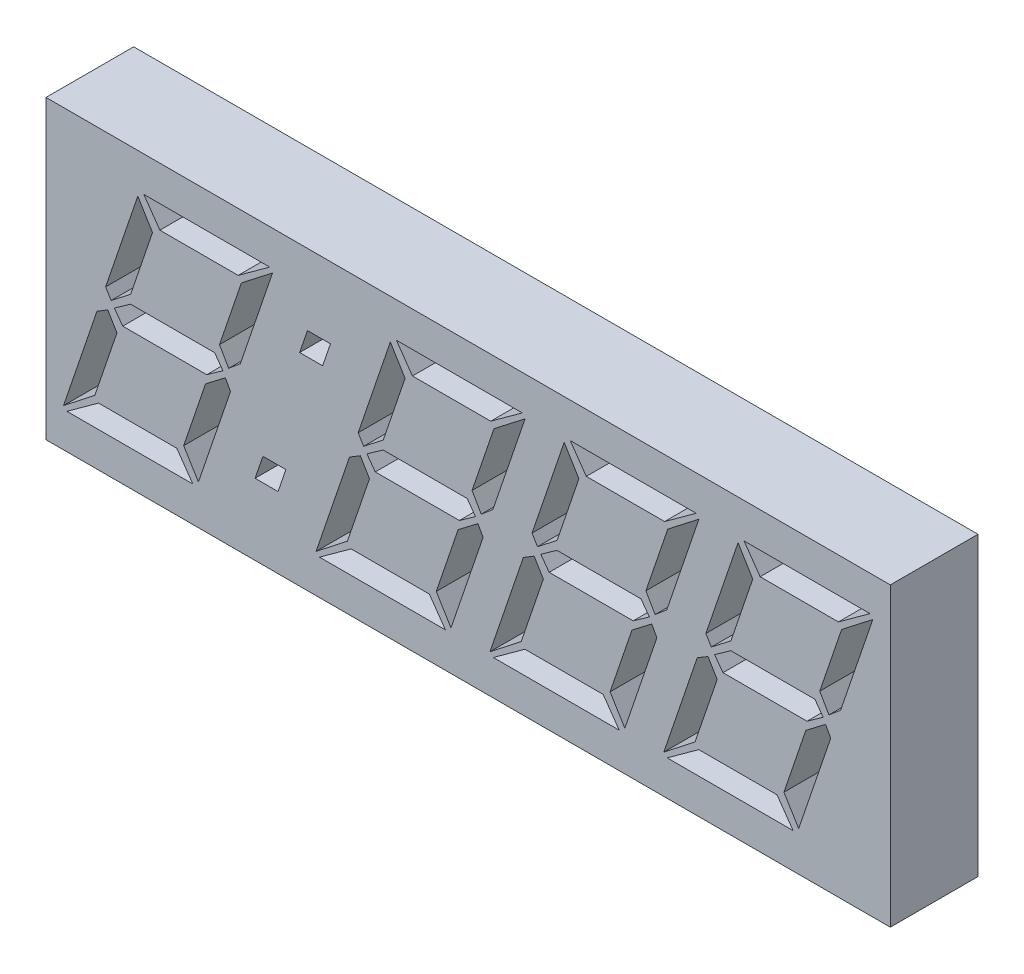
from build123d import *

# Parameters (mm, degrees)
SKETCH_1_W            = 500
SKETCH_1_H            = 220
EXTRUDE_1_DEPTH       = 50
CUT_EXTRUDE_1_DEPTH   = 65
SKETCH_3_W            = 24.993501938
SKETCH_3_H            = 24.754329671
EXTRUDE_2_DEPTH       = 50
SKETCH_4_W            = 557.488309353
SKETCH_4_H            = 263.064748201
SKETCH_4_W_2          = 497.488309353
SKETCH_4_H_2          = 203.064748201
CUT_EXTRUDE_1_2_DEPTH = 84
SCALE_1_SCALE         = 1.5
SKETCH_8_W            = 822.232464029
SKETCH_8_H            = 353.597122302
SKETCH_8_W_2          = 722.232464029
SKETCH_8_H_2          = 253.597122302
CUT_EXTRUDE_2_DEPTH   = 180


with BuildPart() as part:
    # Эскиз1 → Бобышка-Вытянуть1 (new body)
    with BuildSketch(Plane.XY):
        with Locations((315.178539616, -203.237931197)):
            Rectangle(SKETCH_1_W, SKETCH_1_H)
        Polygon((203.546220768, -131.339893042), (185.513397027, -144.433418222), (140.884350264, -144.433418222), (131.736418609, -131.339893042), align=None, mode=Mode.SUBTRACT)
        Polygon((159.677066091, -260.404641243), (87.867263933, -260.404641243), (105.900087674, -247.311116064), (150.529134437, -247.311116064), align=None, mode=Mode.SUBTRACT)
        Polygon((116.392443789, -207.416781531), (103.766544509, -244.593040524), (85.938307098, -258.534137646), (104.994062494, -202.419029733), (111.160879041, -198.678022538), align=None, mode=Mode.SUBTRACT)
        Polygon((109.933361055, -187.922626855), (128.287677602, -133.911835488), (136.67571717, -147.706799517), (124.225177602, -184.41543261), (113.060609257, -193.066511747), align=None, mode=Mode.SUBTRACT)
        Polygon((181.158630839, -203.997267143), (162.86276753, -257.832698797), (154.445501343, -244.066961387), (166.92526753, -207.299875056), (178.20674235, -198.678022538), align=None, mode=Mode.SUBTRACT)
        Polygon((174.874907818, -183.947806711), (187.354674005, -147.239173618), (205.124458178, -133.444209589), (186.770141631, -187.455000956), (180.106472566, -193.066511747), align=None, mode=Mode.SUBTRACT)
        Polygon((172.098379041, -189.325504553), (176.833091271, -195.872267143), (167.626706379, -202.419029733), (119.695051703, -202.419029733), (114.931112854, -195.872267143), (124.166724365, -189.325504553), align=None, mode=Mode.SUBTRACT)
        Polygon((188.173019329, -260.404641243), (192.615465372, -247.311116064), (205.708990552, -247.311116064), (201.266544509, -260.404641243), align=None, mode=Mode.SUBTRACT)
        Polygon((220.585339473, -165.00895779), (225.057012134, -151.91543261), (238.150537314, -151.91543261), (233.678864652, -165.00895779), align=None, mode=Mode.SUBTRACT)
        Polygon((347.574997746, -131.339893042), (329.542174005, -144.433418222), (284.913127242, -144.433418222), (275.765195588, -131.339893042), align=None, mode=Mode.SUBTRACT)
        Polygon((303.70584307, -260.404641243), (231.896040911, -260.404641243), (249.928864652, -247.311116064), (294.557911415, -247.311116064), align=None, mode=Mode.SUBTRACT)
        Polygon((260.421220768, -207.416781531), (247.795321487, -244.593040524), (229.967084077, -258.534137646), (249.022839473, -202.419029733), (255.189656019, -198.678022538), align=None, mode=Mode.SUBTRACT)
        Polygon((253.962138034, -187.922626855), (272.31645458, -133.911835488), (280.704494149, -147.706799517), (268.25395458, -184.41543261), (257.089386235, -193.066511747), align=None, mode=Mode.SUBTRACT)
        Polygon((325.187407818, -203.997267143), (306.891544509, -257.832698797), (298.474278321, -244.066961387), (310.954044509, -207.299875056), (322.235519329, -198.678022538), align=None, mode=Mode.SUBTRACT)
        Polygon((318.903684796, -183.947806711), (331.383450983, -147.239173618), (349.153235156, -133.444209589), (330.798918609, -187.455000956), (324.135249545, -193.066511747), align=None, mode=Mode.SUBTRACT)
        Polygon((316.127156019, -189.325504553), (320.86186825, -195.872267143), (311.655483357, -202.419029733), (263.723828681, -202.419029733), (258.959889832, -195.872267143), (268.195501343, -189.325504553), align=None, mode=Mode.SUBTRACT)
        Polygon((446.711688393, -131.339893042), (428.678864652, -144.433418222), (384.04981789, -144.433418222), (374.901886235, -131.339893042), align=None, mode=Mode.SUBTRACT)
        Polygon((402.842533717, -260.404641243), (331.032731559, -260.404641243), (349.0655553, -247.311116064), (393.694602063, -247.311116064), align=None, mode=Mode.SUBTRACT)
        Polygon((359.557911415, -207.416781531), (346.932012134, -244.593040524), (329.103774724, -258.534137646), (348.15953012, -202.419029733), (354.326346667, -198.678022538), align=None, mode=Mode.SUBTRACT)
        Polygon((353.098828681, -187.922626855), (371.453145228, -133.911835488), (379.841184796, -147.706799517), (367.390645228, -184.41543261), (356.226076883, -193.066511747), align=None, mode=Mode.SUBTRACT)
        Polygon((424.324098465, -203.997267143), (406.028235156, -257.832698797), (397.610968969, -244.066961387), (410.090735156, -207.299875056), (421.372209976, -198.678022538), align=None, mode=Mode.SUBTRACT)
        Polygon((418.040375444, -183.947806711), (430.520141631, -147.239173618), (448.289925804, -133.444209589), (429.935609257, -187.455000956), (423.271940192, -193.066511747), align=None, mode=Mode.SUBTRACT)
        Polygon((415.263846667, -189.325504553), (419.998558897, -195.872267143), (410.792174005, -202.419029733), (362.860519329, -202.419029733), (358.09658048, -195.872267143), (367.332191991, -189.325504553), align=None, mode=Mode.SUBTRACT)
        Polygon((545.848379041, -131.339893042), (527.8155553, -144.433418222), (483.186508537, -144.433418222), (474.038576883, -131.339893042), align=None, mode=Mode.SUBTRACT)
        Polygon((501.979224365, -260.404641243), (430.169422206, -260.404641243), (448.202245947, -247.311116064), (492.83129271, -247.311116064), align=None, mode=Mode.SUBTRACT)
        Polygon((458.694602063, -207.416781531), (446.068702782, -244.593040524), (428.240465372, -258.534137646), (447.296220768, -202.419029733), (453.463037314, -198.678022538), align=None, mode=Mode.SUBTRACT)
        Polygon((452.235519329, -187.922626855), (470.589835875, -133.911835488), (478.977875444, -147.706799517), (466.527335875, -184.41543261), (455.36276753, -193.066511747), align=None, mode=Mode.SUBTRACT)
        Polygon((523.460789113, -203.997267143), (505.164925804, -257.832698797), (496.747659616, -244.066961387), (509.227425804, -207.299875056), (520.508900624, -198.678022538), align=None, mode=Mode.SUBTRACT)
        Polygon((517.177066091, -183.947806711), (529.656832278, -147.239173618), (547.426616451, -133.444209589), (529.072299904, -187.455000956), (522.408630839, -193.066511747), align=None, mode=Mode.SUBTRACT)
        Polygon((514.400537314, -189.325504553), (519.135249545, -195.872267143), (509.928864652, -202.419029733), (461.997209976, -202.419029733), (457.233271127, -195.872267143), (466.468882638, -189.325504553), align=None, mode=Mode.SUBTRACT)
    extrude(amount=EXTRUDE_1_DEPTH)

    # Эскиз2 → Cut-Extrude 1 (cut)
    with BuildSketch(Plane.XY.offset(50)):
        Polygon((225.057012134, -151.91543261), (238.150537314, -151.91543261), (233.678864652, -165.00895779), (220.585339473, -165.00895779), align=None)
        Polygon((199.643902872, -226.731116064), (212.737428052, -226.731116064), (208.26575539, -239.824641243), (195.17223021, -239.824641243), align=None)
    extrude(amount=-CUT_EXTRUDE_1_DEPTH, mode=Mode.SUBTRACT)

    # Эскиз3 → Бобышка-Вытянуть2 (add)
    with BuildSketch(Plane.XY.offset(50)):
        with Locations((196.457377331, -256.289777907)):
            Rectangle(SKETCH_3_W, SKETCH_3_H)
    extrude(amount=-EXTRUDE_2_DEPTH)

    # Эскиз4 → Cut-Extrude 1 2 (cut)
    with BuildSketch(Plane.XY.offset(50)):
        with Locations((316.682461775, -195.872267142)):
            Rectangle(SKETCH_4_W, SKETCH_4_H)
        with Locations((316.682461775, -195.872267142)):
            Rectangle(SKETCH_4_W_2, SKETCH_4_H_2, mode=Mode.SUBTRACT)
    extrude(amount=-CUT_EXTRUDE_1_2_DEPTH, mode=Mode.SUBTRACT)


with BuildPart() as part_1:
    # Масштаб1: scaled about (314.289349403, -195.861916492, 25)
    add(part.part.scale(SCALE_1_SCALE).moved(Location((-157.144674702, 97.930958246, -12.5))))

    # Эскиз8 → Вырез-Вытянуть-Тонкостенный2 (cut)
    with BuildSketch(Plane.XY.offset(62.5)):
        with Locations((317.879017961, -195.877442468)):
            Rectangle(SKETCH_8_W, SKETCH_8_H)
        with Locations((317.879017961, -195.877442468)):
            Rectangle(SKETCH_8_W_2, SKETCH_8_H_2, mode=Mode.SUBTRACT)
    extrude(amount=-CUT_EXTRUDE_2_DEPTH, mode=Mode.SUBTRACT)


solid = part_1.part
